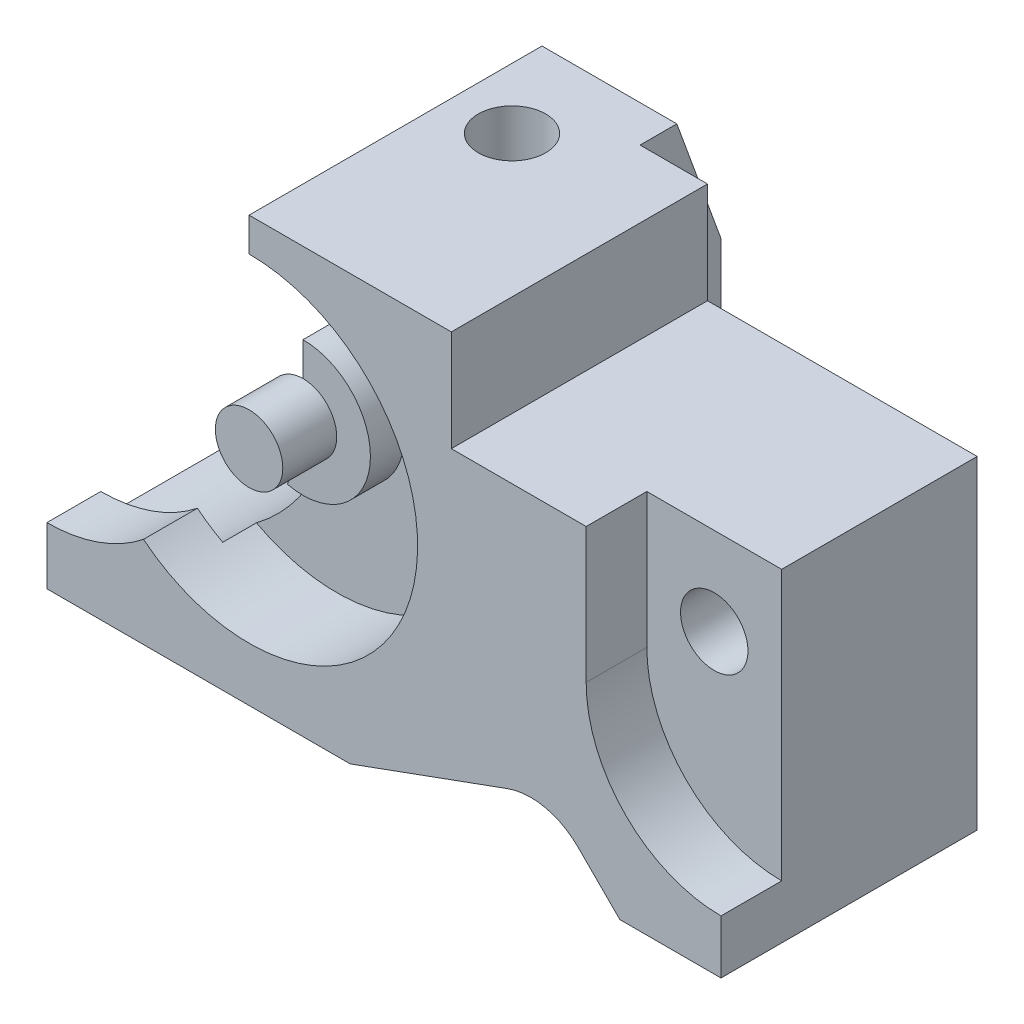
from build123d import *

# Parameters (mm, degrees)
BOSS_EXTRUDE2_DEPTH      = 50
SKETCH2_R                = 5
CUT_EXTRUDE1_DEPTH       = 78.409624725
SKETCH2_5_R              = 5
CUT_EXTRUDE2_DEPTH       = 9
CUT_EXTRUDE12_DEPTH      = 78.409624725
CUT_EXTRUDE12_DEPTH_BACK = 42
CUT_EXTRUDE14_DEPTH      = 42
CUT_EXTRUDE16_DEPTH      = 78.409624725
CUT_EXTRUDE16_DEPTH_BACK = 78.409624725
SKETCH41_R               = 25
CUT_EXTRUDE17_DEPTH      = 13
BOSS_EXTRUDE8_START      = 5
BOSS_EXTRUDE8_DEPTH      = 5
SKETCH43_R               = 5
BOSS_EXTRUDE9_DEPTH      = 8
CUT_EXTRUDE19_DEPTH      = 92.609224426
CUT_EXTRUDE21_DEPTH      = 86.463442477
CUT_EXTRUDE21_DEPTH_BACK = 86.463442477
SKETCH45_W               = 50
SKETCH45_H               = 12
SKETCH46_R               = 5
CUT_EXTRUDE22_DEPTH      = 95.704804524


with BuildPart() as part:
    # Sketch1 → Boss-Extrude2 (new body)
    with BuildSketch(Plane.XY):
        with BuildLine():
            Line((10, 16.5), (10, 31.5))
            Line((10, 31.5), (-50, 31.5))
            Line((-50, 31.5), (-50, -31.5))
            Line((-50, -31.5), (-5, -31.5))
            Line((-5, -31.5), (18.339650933, -23.005061782))
            ThreePointArc((18.339650933, -23.005061782), (23.924248506, -22.639027919), (28.830920178, -25.330920178))
            Line((28.830920178, -25.330920178), (35, -31.5))
            Line((35, -31.5), (50, -31.5))
            Line((50, -31.5), (50, 16.5))
            Line((50, 16.5), (10, 16.5))
        make_face()
    extrude(amount=BOSS_EXTRUDE2_DEPTH)

    # Sketch2 → Cut-Extrude1 (cut, through all)
    with BuildSketch(Plane.XY.offset(50)):
        with Locations((40, 3.5)):
            Circle(SKETCH2_R)
    extrude(amount=-CUT_EXTRUDE1_DEPTH, mode=Mode.SUBTRACT)

    # Sketch2<5> → Cut-Extrude2 (cut)
    with BuildSketch(Plane.XY.offset(50)):
        with BuildLine():
            Line((50, 16.5), (30, 16.5))
            Line((30, 16.5), (30, -3.523038751))
            ThreePointArc((30, -3.523038751), (35.857864376, -17.665174375), (50, -23.523038751))
            Line((50, -23.523038751), (50, 16.5))
        make_face()
        with Locations((40, 3.5)):
            Circle(SKETCH2_5_R, mode=Mode.SUBTRACT)
    extrude(amount=-CUT_EXTRUDE2_DEPTH, mode=Mode.SUBTRACT)

    # Sketch30 → Cut-Extrude12 (cut, two sides: drawn at the far end of the back side and taken through both)
    with BuildSketch(Plane(origin=(0, 0, 0), x_dir=(-1, 0, 0), z_dir=(0, 0, -1)).offset(-CUT_EXTRUDE12_DEPTH_BACK)):
        with BuildLine():
            Line((291.204939457, -25.963430676), (50, -26.5))
            ThreePointArc((50, -26.5), (29.463716543, -18.431732275), (20, 1.5))
            Line((20, 1.5), (20, 31.5))
            Line((20, 31.5), (20, 272.705536266))
            Line((20, 272.705536266), (377.141103264, 597.005821897))
            Line((377.141103264, 597.005821897), (648.346042721, 298.336854955))
            Line((648.346042721, 298.336854955), (291.204939457, -25.963430676))
        make_face()
    extrude(amount=CUT_EXTRUDE12_DEPTH + CUT_EXTRUDE12_DEPTH_BACK, mode=Mode.SUBTRACT)

    # Sketch15 → Cut-Extrude14 (cut)
    with BuildSketch(Plane.XY.offset(50)):
        with BuildLine():
            Line((-20, 1.5), (-20, 26.5))
            ThreePointArc((-20, 26.5), (-44.154267569, 7.947585455), (-32.45893634, -20.174291344))
            ThreePointArc((-32.45893634, -20.174291344), (-23.864179013, -10.696774301), (-20, 1.5))
        make_face()
    extrude(amount=-CUT_EXTRUDE14_DEPTH, mode=Mode.SUBTRACT)

    # Sketch39 → Cut-Extrude16 (cut, two sides: drawn at the far end of the back side and taken through both)
    with BuildSketch(Plane.XY.offset(50).offset(-CUT_EXTRUDE16_DEPTH_BACK)):
        with BuildLine():
            Line((-50, 31.5), (-50, -23))
            ThreePointArc((-50, -23), (-42.405705612, -21.710059713), (-35.66325351, -17.984929805))
            ThreePointArc((-35.66325351, -17.984929805), (-43.580958898, 9.802913792), (-20, 26.5))
            Line((-20, 26.5), (-20, 31.5))
            Line((-20, 31.5), (-50, 31.5))
        make_face()
    extrude(amount=CUT_EXTRUDE16_DEPTH + CUT_EXTRUDE16_DEPTH_BACK, mode=Mode.SUBTRACT)

    # Sketch41 → Cut-Extrude17 (cut)
    with BuildSketch(Plane.XY.offset(50)):
        with Locations((-20, 1.5)):
            Circle(SKETCH41_R)
    extrude(amount=-CUT_EXTRUDE17_DEPTH, mode=Mode.SUBTRACT)

    # Sketch42 → Boss-Extrude8 (add)
    with BuildSketch(Plane.XY.offset(37).offset(BOSS_EXTRUDE8_START)):
        with BuildLine():
            Line((-20, 11.5), (-20, 1.5))
            ThreePointArc((-20, 1.5), (-20.751988631, -3.460904975), (-22.320276916, -8.227091808))
            ThreePointArc((-22.320276916, -8.227091808), (-10.068461396, 0.331864322), (-20, 11.5))
        make_face()
    extrude(amount=-BOSS_EXTRUDE8_DEPTH)

    # Sketch43 → Boss-Extrude9 (add)
    with BuildSketch(Plane.XY.offset(42)):
        with Locations(Location((-20, 1.5, 0), (0, 0, 261.397396505))):
            Circle(SKETCH43_R)
    extrude(amount=BOSS_EXTRUDE9_DEPTH)

    # Sketch44 → Cut-Extrude19 (cut, through all)
    with BuildSketch(Plane.ZY.offset(20)):
        Polygon((0, 13.5), (6.551464217, 31.5), (0, 31.5), align=None)
    extrude(amount=-CUT_EXTRUDE19_DEPTH, mode=Mode.SUBTRACT)

    # Sketch45 → Cut-Extrude21 (cut, two sides: drawn at the far end of the back side and taken through both)
    with BuildSketch(Plane(origin=(0, 16.5, 0), x_dir=(1, 0, 0), z_dir=(0, 1, 0)).offset(-CUT_EXTRUDE21_DEPTH_BACK)):
        with Locations((25, -6)):
            Rectangle(SKETCH45_W, SKETCH45_H)
    extrude(amount=CUT_EXTRUDE21_DEPTH + CUT_EXTRUDE21_DEPTH_BACK, mode=Mode.SUBTRACT)

    # Sketch46 → Cut-Extrude22 (cut, through all)
    with BuildSketch(Plane(origin=(0, 31.5, 0), x_dir=(1, 0, 0), z_dir=(0, 1, 0))):
        with Locations(Location((-11, -20, 0), (0, 0, 180))):
            Circle(SKETCH46_R)
    extrude(amount=-CUT_EXTRUDE22_DEPTH, mode=Mode.SUBTRACT)


solid = part.part
